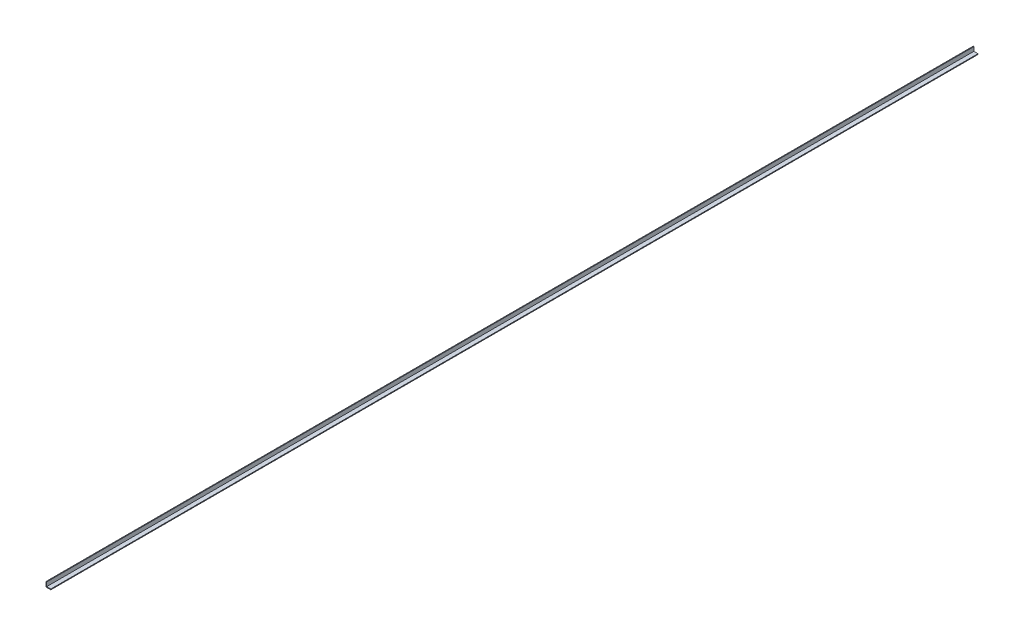
from build123d import *

# Parameters (mm, degrees)
SALIENTE_EXTRUIR1_DEPTH = 6100


with BuildPart() as part:
    # Croquis1 → Saliente-Extruir1 (new body)
    with BuildSketch(Plane.XY):
        Polygon((0, 31.75), (0, 0), (31.75, 0), (31.75, 4.76), (4.76, 4.76), (4.76, 31.75), align=None)
    extrude(amount=-SALIENTE_EXTRUIR1_DEPTH)


solid = part.part
